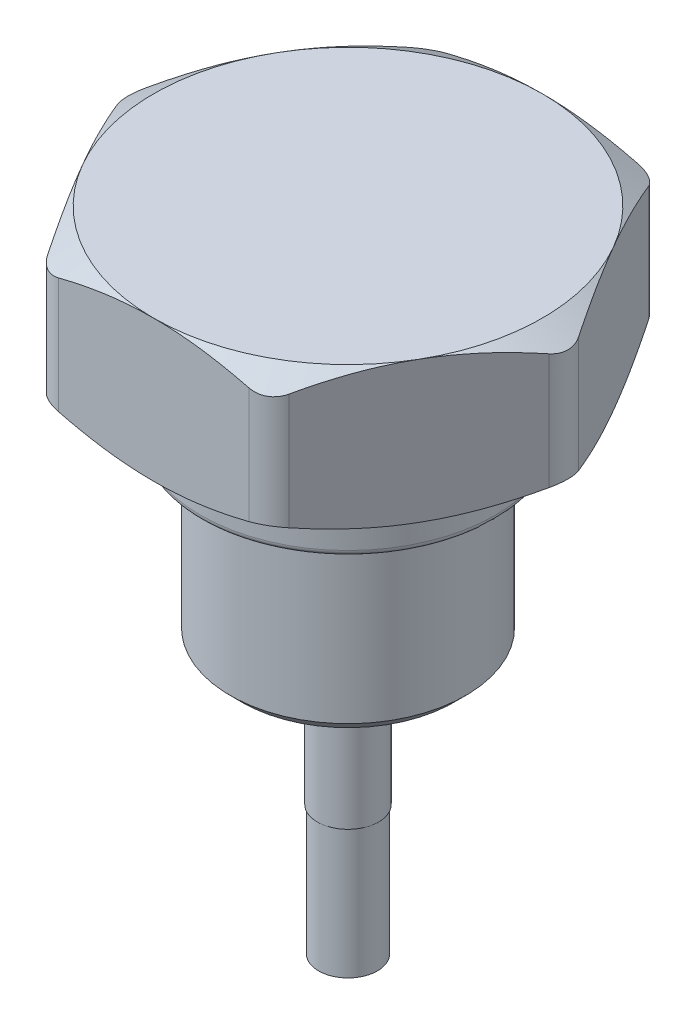
from build123d import *

# Parameters (mm, degrees)
BOSS_EXTRUDE2_DEPTH  = 12
SKETCH4_OUTSIDE_W    = 92.038
SKETCH4_OUTSIDE_H    = 86.932
SKETCH4_OUTSIDE_R    = 16.5
CUT_EXTRUDE6_DEPTH   = 12
CUT_EXTRUDE6_DRAFT   = -60
SKETCH5_OUTSIDE_W    = 92.038
SKETCH5_OUTSIDE_H    = 86.932
SKETCH5_OUTSIDE_R    = 16.5
CUT_EXTRUDE7_DEPTH   = 12
CUT_EXTRUDE7_DRAFT   = -60
FILLET1_R            = 2.5
SKETCH9_R            = 12.5
BOSS_EXTRUDE6_DEPTH  = 5
SKETCH11_R           = 10
BOSS_EXTRUDE8_DEPTH  = 15
CHAMFER1_SIZE        = 1
FILLET2_R            = 0.5
SKETCH12_R           = 2.6
BOSS_EXTRUDE9_DEPTH  = 12
SKETCH13_R           = 2.5
BOSS_EXTRUDE10_DEPTH = 11


with BuildPart() as part:
    # Sketch3 → Boss-Extrude2 (new body)
    with BuildSketch(Plane(origin=(0, 0, 0), x_dir=(1, 0, 0), z_dir=(0, 1, 0))):
        Polygon((19.052558883, 0), (9.526279442, 16.5), (-9.526279442, 16.5), (-19.052558883, 0), (-9.526279442, -16.5), (9.526279442, -16.5), align=None)
    extrude(amount=BOSS_EXTRUDE2_DEPTH)


with BuildPart() as cut_extrude6_tool:
    # Sketch4 outside → Cut-Extrude6 (with draft: the straight prism first)
    with BuildSketch(Plane(origin=(0, 12, 0), x_dir=(1, 0, 0), z_dir=(0, 1, 0))):
        Rectangle(SKETCH4_OUTSIDE_W, SKETCH4_OUTSIDE_H)
        Circle(SKETCH4_OUTSIDE_R, mode=Mode.SUBTRACT)
    extrude(amount=-CUT_EXTRUDE6_DEPTH)
    # Cut-Extrude6: the draft: its side faces are tilted about the plane it starts from
    cut_extrude6_sides = [cut_extrude6_tool.faces().sort_by_distance(p)[0] for p in [
        (0, 6, 43.466),
        (46.019, 6, 0),
        (0, 6, -43.466),
        (-46.019, 6, 0),
        (-16.5, 6, 0),
    ]]
    draft(cut_extrude6_sides, Plane(origin=(0, 12, 0), x_dir=(1, 0, 0), z_dir=(0, 1, 0)), CUT_EXTRUDE6_DRAFT)


with BuildPart() as part_1:
    add(part.part)

    # Cut-Extrude6: cut by cut_extrude6_tool
    add(cut_extrude6_tool.part, mode=Mode.SUBTRACT)


with BuildPart() as cut_extrude7_tool:
    # Sketch5 outside → Cut-Extrude7 (with draft: the straight prism first)
    with BuildSketch(Plane.XZ):
        Rectangle(SKETCH5_OUTSIDE_W, SKETCH5_OUTSIDE_H)
        Circle(SKETCH5_OUTSIDE_R, mode=Mode.SUBTRACT)
    extrude(amount=-CUT_EXTRUDE7_DEPTH)
    # Cut-Extrude7: the draft: its side faces are tilted about the plane it starts from
    cut_extrude7_sides = [cut_extrude7_tool.faces().sort_by_distance(p)[0] for p in [
        (0, 6, -43.466),
        (46.019, 6, 0),
        (0, 6, 43.466),
        (-46.019, 6, 0),
        (-16.5, 6, 0),
    ]]
    draft(cut_extrude7_sides, Plane.XZ, CUT_EXTRUDE7_DRAFT)


with BuildPart() as part_2:
    add(part_1.part)

    # Cut-Extrude7: cut by cut_extrude7_tool
    add(cut_extrude7_tool.part, mode=Mode.SUBTRACT)

    # Fillet1
    fillet1_edges = [part_2.edges().sort_by_distance(p)[0] for p in [
        (-19.052558883, 6, 0),
        (-9.526279442, 6, -16.5),
        (9.526279442, 6, -16.5),
        (19.052558883, 6, 0),
        (-9.526279442, 6, 16.5),
        (9.526279442, 6, 16.5),
    ]]
    fillet(fillet1_edges, radius=FILLET1_R)

    # Sketch9 → Boss-Extrude6 (add)
    with BuildSketch(Plane.XZ):
        with Locations(Location((0, 0, 0), (0, 0, 90))):
            Circle(SKETCH9_R)
    extrude(amount=BOSS_EXTRUDE6_DEPTH)

    # Sketch11 → Boss-Extrude8 (add)
    with BuildSketch(Plane.XZ.offset(5)):
        with Locations(Location((0, 0, 0), (0, 0, 270))):
            Circle(SKETCH11_R)
    extrude(amount=BOSS_EXTRUDE8_DEPTH)

    # Chamfer1
    chamfer1_edges = [part_2.edges().sort_by_distance(p)[0] for p in [
        (0, -20, 10),
    ]]
    chamfer(chamfer1_edges, length=CHAMFER1_SIZE)

    # Fillet2
    fillet2_edges = [part_2.edges().sort_by_distance(p)[0] for p in [
        (0, 0, -12.5),
        (0, -5, -12.5),
    ]]
    fillet(fillet2_edges, radius=FILLET2_R)

    # Sketch12 → Boss-Extrude9 (add)
    with BuildSketch(Plane.XZ.offset(20)):
        with Locations(Location((0, 0, 0), (0, 0, 270))):
            Circle(SKETCH12_R)
    extrude(amount=BOSS_EXTRUDE9_DEPTH)

    # Sketch13 → Boss-Extrude10 (add)
    with BuildSketch(Plane.XZ.offset(32)):
        with Locations(Location((0, 0, 0), (0, 0, 270))):
            Circle(SKETCH13_R)
    extrude(amount=BOSS_EXTRUDE10_DEPTH)


solid = part_2.part
